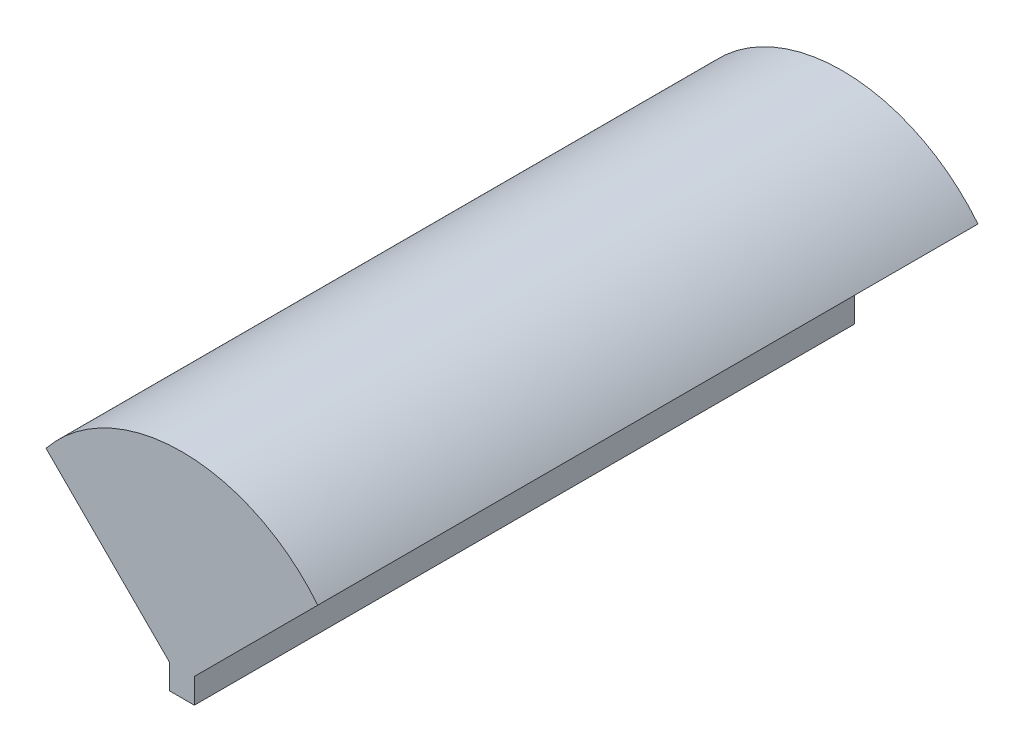
from build123d import *

# Parameters (mm, degrees)
BOSS_EXTRUDE1_DEPTH = 52.96


with BuildPart() as part:
    # Sketch1 → Boss-Extrude1 (new body)
    with BuildSketch(Plane.XY):
        with BuildLine():
            Line((0, 0), (0, 2))
            Line((0, 2), (-9.899494937, 11.899494937))
            ThreePointArc((-9.899494937, 11.899494937), (1, 17.113084399), (11.899494937, 11.899494937))
            Line((11.899494937, 11.899494937), (2, 2))
            Line((2, 2), (2, 0))
            Line((2, 0), (0, 0))
        make_face()
    extrude(amount=BOSS_EXTRUDE1_DEPTH)


solid = part.part
